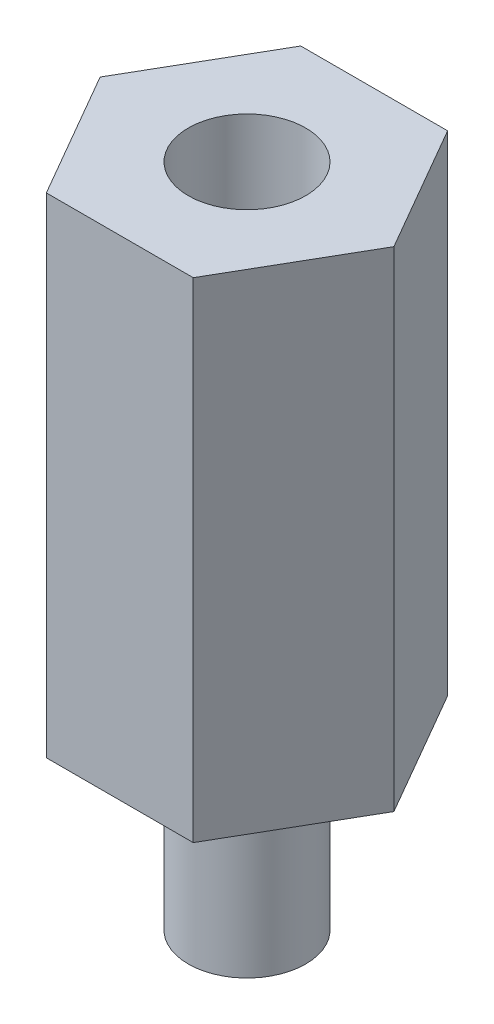
from build123d import *

# Parameters (mm, degrees)
BOSS_EXTRUDE1_DEPTH       = 25
SKETCH2_R                 = 3
BOSS_EXTRUDE2_DEPTH       = 9
F_6_0MM_DOWEL_HOLE1_D     = 6
F_6_0MM_DOWEL_HOLE1_DEPTH = 9
F_6_0MM_DOWEL_HOLE1_TIP   = 1.802581857


with BuildPart() as part:
    # Sketch1 → Boss-Extrude1 (new body)
    with BuildSketch(Plane(origin=(0, 0, 0), x_dir=(1, 0, 0), z_dir=(0, 1, 0))):
        Polygon((7.505553499, 0), (3.75277675, 6.5), (-3.75277675, 6.5), (-7.505553499, 0), (-3.75277675, -6.5), (3.75277675, -6.5), align=None)
    extrude(amount=BOSS_EXTRUDE1_DEPTH)

    # Sketch2 → Boss-Extrude2 (add)
    with BuildSketch(Plane.XZ):
        with Locations(Location((0, 0, 0), (0, 0, 90))):
            Circle(SKETCH2_R)
    extrude(amount=BOSS_EXTRUDE2_DEPTH)

    # Ø6.0mm Dowel Hole1
    with Locations(Plane(origin=(0, 25, 0), x_dir=(1, 0, 0), z_dir=(0, 1, 0))):
        with Locations((0, 0)):
            Hole(F_6_0MM_DOWEL_HOLE1_D / 2, depth=F_6_0MM_DOWEL_HOLE1_DEPTH)
            with Locations((0, 0, -(F_6_0MM_DOWEL_HOLE1_DEPTH + F_6_0MM_DOWEL_HOLE1_TIP / 2))):  # 118° drill point
                Cone(0, F_6_0MM_DOWEL_HOLE1_D / 2, F_6_0MM_DOWEL_HOLE1_TIP, mode=Mode.SUBTRACT)


solid = part.part
